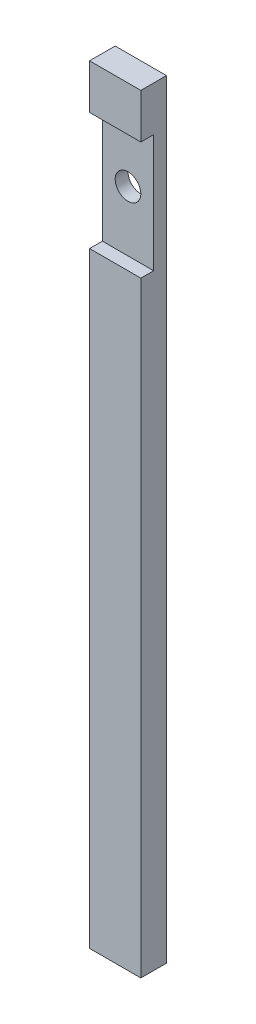
from build123d import *

# Parameters (mm, degrees)
SKETCH1_W           = 25.4
SKETCH1_H           = 12.7
BOSS_EXTRUDE1_DEPTH = 381
SKETCH2_R           = 6.35
CUT_EXTRUDE1_DEPTH  = 383.056867495
SKETCH3_W           = 25.4
SKETCH3_H           = 58.414427835
CUT_EXTRUDE2_DEPTH  = 6.35


with BuildPart() as part:
    # Sketch1 → Boss-Extrude1 (new body)
    with BuildSketch(Plane(origin=(0, 0, 0), x_dir=(1, 0, 0), z_dir=(0, 1, 0))):
        with Locations((12.7, 6.35)):
            Rectangle(SKETCH1_W, SKETCH1_H)
    extrude(amount=BOSS_EXTRUDE1_DEPTH)

    # Sketch2 → Cut-Extrude1 (cut, through all)
    with BuildSketch(Plane.XY):
        with Locations(Location((12.7, 330.2, 0), (0, 0, 180))):
            Circle(SKETCH2_R)
    extrude(amount=-CUT_EXTRUDE1_DEPTH, mode=Mode.SUBTRACT)

    # Sketch3 → Cut-Extrude2 (cut)
    with BuildSketch(Plane.XY):
        with Locations((12.7, 329.619745597)):
            Rectangle(SKETCH3_W, SKETCH3_H)
    extrude(amount=-CUT_EXTRUDE2_DEPTH, mode=Mode.SUBTRACT)


solid = part.part
